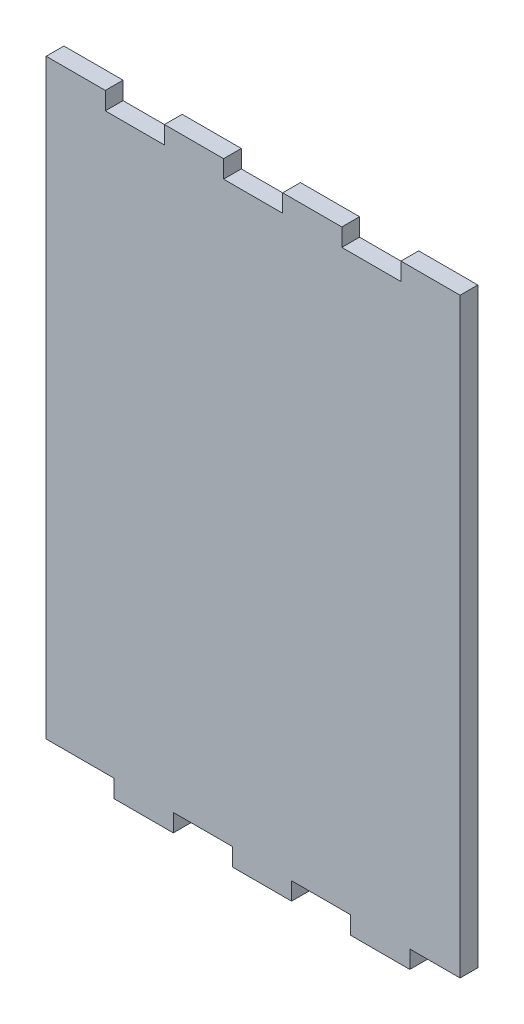
from build123d import *

# Parameters (mm, degrees)
SKETCH1_W           = 70
SKETCH1_H           = 100
SKETCH1_W_2         = 10
SKETCH1_H_2         = 3
BOSS_EXTRUDE1_DEPTH = 3
SKETCH2_W           = 10
SKETCH2_H           = 3
CUT_EXTRUDE1_DEPTH  = 64.584589328


with BuildPart() as part:
    # Sketch1 → Boss-Extrude1 (new body)
    with BuildSketch(Plane.XY):
        Rectangle(SKETCH1_W, SKETCH1_H)
        with Locations((21.5, -51.5)):
            Rectangle(SKETCH1_W_2, SKETCH1_H_2)
        with Locations((1.5, -51.5)):
            Rectangle(SKETCH1_W_2, SKETCH1_H_2)
        with Locations((-18.5, -51.5)):
            Rectangle(SKETCH1_W_2, SKETCH1_H_2)
    extrude(amount=BOSS_EXTRUDE1_DEPTH)

    # Sketch2 → Cut-Extrude1 (cut, through all)
    with BuildSketch(Plane.XY.offset(3)):
        with Locations((-20, 48.5)):
            Rectangle(SKETCH2_W, SKETCH2_H)
        with Locations((0, 48.5)):
            Rectangle(SKETCH2_W, SKETCH2_H)
        with Locations((20, 48.5)):
            Rectangle(SKETCH2_W, SKETCH2_H)
    extrude(amount=-CUT_EXTRUDE1_DEPTH, mode=Mode.SUBTRACT)


solid = part.part
